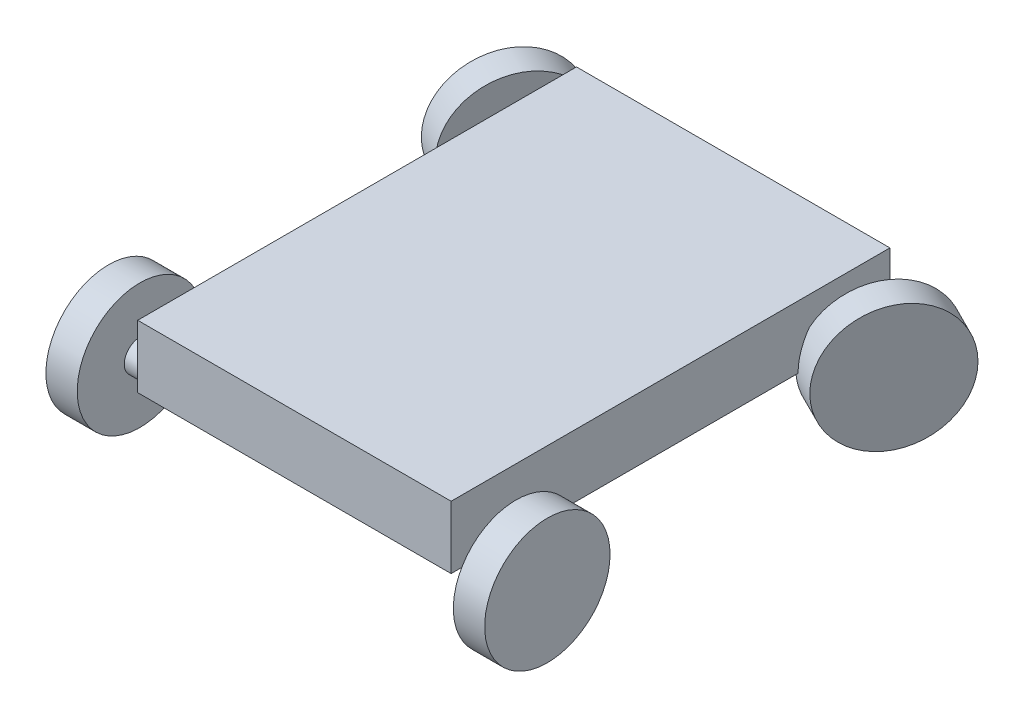
from build123d import *

# Parameters (mm, degrees)
CROQUIS2_W                 = 50
CROQUIS2_H                 = 70
SALIENTE_EXTRUIR1_DEPTH    = 10
CROQUIS4_R                 = 2.5
SALIENTE_EXTRUIR2_DEPTH    = 30
CROQUIS5_R                 = 10
SALIENTE_EXTRUIR3_DEPTH    = 5
CORTAR_EXTRUIR1_DEPTH      = 5
CORTAR_EXTRUIR1_DEPTH_BACK = 5
CROQUIS8_R                 = 10
SALIENTE_EXTRUIR4_DEPTH    = 5
CROQUIS9_R                 = 10
SALIENTE_EXTRUIR5_DEPTH    = 5


with BuildPart() as part:
    # Croquis2 → Saliente-Extruir1 (new body)
    with BuildSketch(Plane(origin=(0, 0, 0), x_dir=(1, 0, 0), z_dir=(0, 1, 0))):
        Rectangle(CROQUIS2_W, CROQUIS2_H)
    extrude(amount=SALIENTE_EXTRUIR1_DEPTH)

    # Croquis4 → Saliente-Extruir2 (add, symmetric)
    with BuildSketch(Plane(origin=(0, 0, 0), x_dir=(0, 0, -1), z_dir=(1, 0, 0))):
        with Locations((-29.646809276, 0)):
            Circle(CROQUIS4_R)
    saliente_extruir2 = extrude(amount=SALIENTE_EXTRUIR2_DEPTH, both=True)

    # Croquis5 → Saliente-Extruir3 (add)
    with BuildSketch(Plane(origin=(30, 0, 0), x_dir=(0, 0, -1), z_dir=(1, 0, 0))):
        with Locations((-29.646809276, 0)):
            Circle(CROQUIS5_R)
    saliente_extruir3 = extrude(amount=SALIENTE_EXTRUIR3_DEPTH)

    # Simetría1: Saliente-Extruir3 across plane
    add(saliente_extruir3.mirror(Plane(origin=(0, 0, 0), x_dir=(0, 0, 1), z_dir=(1, 0, 0))))

    # Simetría2: Saliente-Extruir2 across plane
    add(saliente_extruir2.mirror(Plane.XY))

    # Croquis7 → Cortar-Extruir1 (cut, two sides: drawn at the far end of the back side and taken through both)
    with BuildSketch(Plane(origin=(0, 0, 0), x_dir=(1, 0, 0), z_dir=(0, 1, 0)).offset(-CORTAR_EXTRUIR1_DEPTH_BACK)):
        Polygon((-30, 27.146809276), (-27.5, 32.146809276), (-30, 32.146809276), align=None)
        Polygon((30, 32.146809276), (27.5, 27.146809276), (30, 27.146809276), align=None)
    extrude(amount=CORTAR_EXTRUIR1_DEPTH + CORTAR_EXTRUIR1_DEPTH_BACK, mode=Mode.SUBTRACT)

    # Croquis8 → Saliente-Extruir4 (add)
    with BuildSketch(Plane(origin=(11.14127629, 0, 5.570638145), x_dir=(0.4472135954999586, 0, -0.8944271909999156), z_dir=(0.8944271909999156, 0, 0.4472135954999586))):
        with Locations(Location((39.374303213, 0, 0), (0, 0, 180))):
            Circle(CROQUIS8_R)
    extrude(amount=SALIENTE_EXTRUIR4_DEPTH)

    # Croquis9 → Saliente-Extruir5 (add)
    with BuildSketch(Plane(origin=(-34.85872371, 0, -17.429361855), x_dir=(-0.44721359549995665, 0, 0.8944271909999165), z_dir=(-0.8944271909999165, 0, -0.44721359549995665))):
        with Locations((-13.659521472, 0)):
            Circle(CROQUIS9_R)
    extrude(amount=SALIENTE_EXTRUIR5_DEPTH)


solid = part.part
